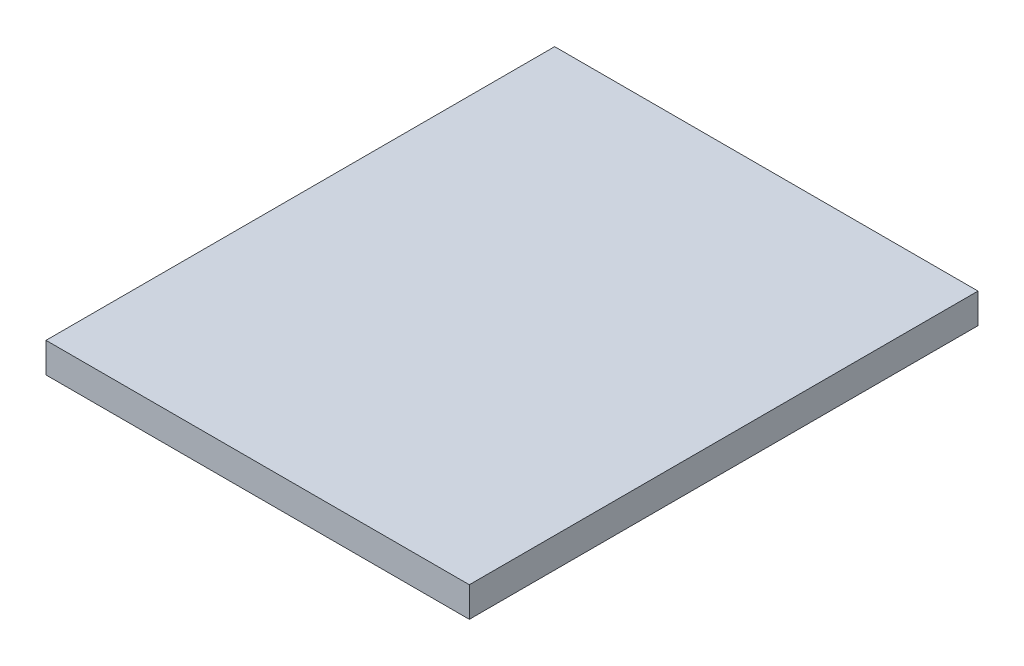
from build123d import *

# Parameters (mm, degrees)
SKETCH1_W           = 89.63
SKETCH1_H           = 107.7
BOSS_EXTRUDE1_DEPTH = 6.35


with BuildPart() as part:
    # Sketch1 → Boss-Extrude1 (new body)
    with BuildSketch(Plane(origin=(0, 0, 0), x_dir=(1, 0, 0), z_dir=(0, 1, 0))):
        Rectangle(SKETCH1_W, SKETCH1_H)
    extrude(amount=BOSS_EXTRUDE1_DEPTH)


solid = part.part
